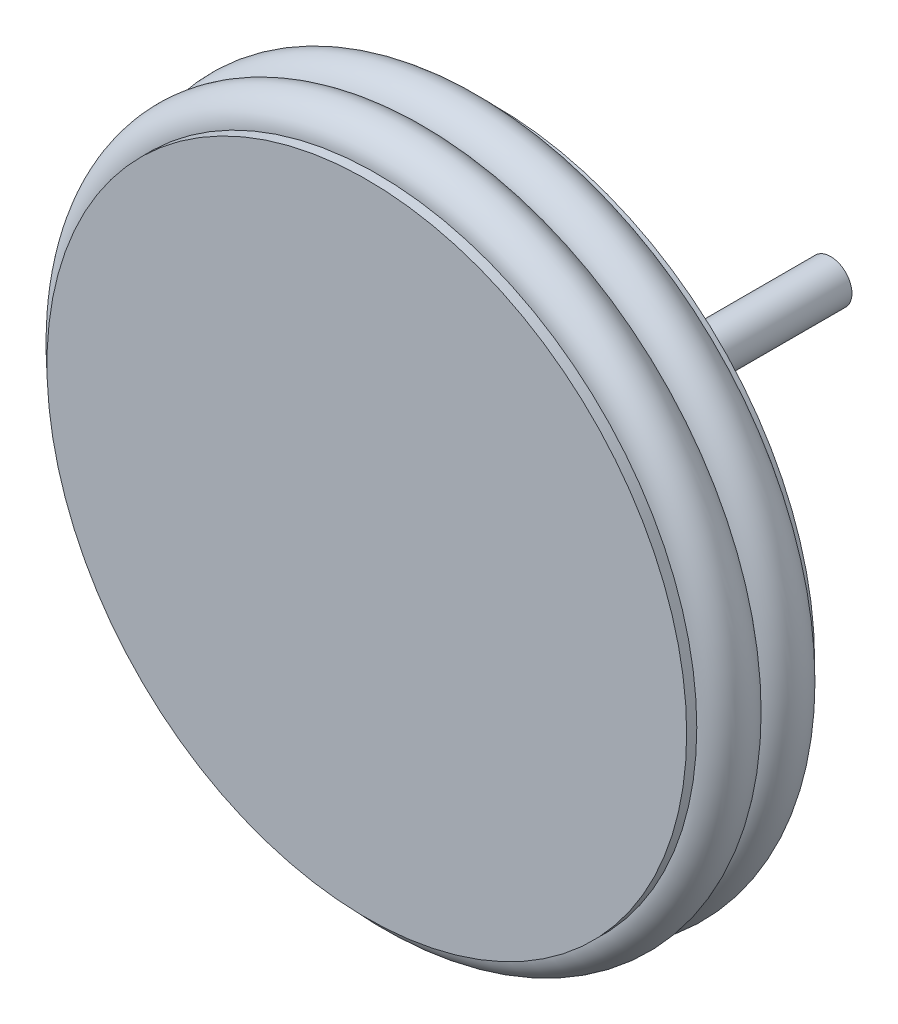
from build123d import *

# Parameters (mm, degrees)
SWEEP1_PROFILE_R    = 5
SKETCH12_R          = 60
BOSS_EXTRUDE1_DEPTH = 2
LPATTERN1_COUNT     = 2
LPATTERN1_PITCH     = 22
SKETCH13_R          = 20
BOSS_EXTRUDE2_DEPTH = 3
SKETCH14_R          = 4
BOSS_EXTRUDE3_DEPTH = 60
LPATTERN5_COUNT     = 2
LPATTERN5_PITCH     = 10.1


with BuildPart() as part:
    # Sweep1: sweep along a path in Sketch1
    with BuildLine(Plane.XY) as sweep1_path:
        CenterArc((0, 0), 60, 0, 360)
    # Sweep1 profile (on start of the path) → Sweep1 (sweep)
    with BuildSketch(Plane(origin=(60, 0, 0), x_dir=(0, 0, 1), z_dir=(0, 1, 0))):
        Circle(SWEEP1_PROFILE_R)
    sweep1 = sweep(path=sweep1_path.line)


with BuildPart() as body_2:
    # Sketch12 → Boss-Extrude1 (new body)
    with BuildSketch(Plane.XY.offset(15)):
        Circle(SKETCH12_R)
    boss_extrude1 = extrude(amount=BOSS_EXTRUDE1_DEPTH)

    # LPattern5: Sweep1 ×2
    with Locations(*[(0, 0, i * LPATTERN5_PITCH) for i in range(1, LPATTERN5_COUNT)]):
        add(sweep1)


with BuildPart() as lpattern1_1:
    # LPattern1: Boss-Extrude1 ×2
    with Locations(*[(0, 0, -i * LPATTERN1_PITCH) for i in range(1, LPATTERN1_COUNT)]):
        add(boss_extrude1)

    # Sketch13 → Boss-Extrude2 (add)
    with BuildSketch(Plane(origin=(0, 0, -7), x_dir=(-1, 0, 0), z_dir=(0, 0, -1))):
        Circle(SKETCH13_R)
    extrude(amount=BOSS_EXTRUDE2_DEPTH)

    # Sketch14 → Boss-Extrude3 (add)
    with BuildSketch(Plane(origin=(0, 0, -10), x_dir=(-1, 0, 0), z_dir=(0, 0, -1))):
        with Locations(Location((0, 0, 0), (0, 0, 180))):
            Circle(SKETCH14_R)
    extrude(amount=BOSS_EXTRUDE3_DEPTH)


solid = Compound([part.part, body_2.part, lpattern1_1.part])
